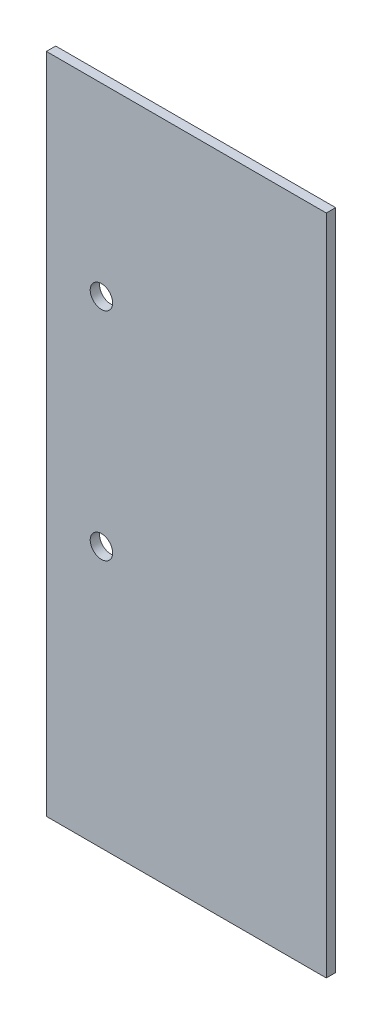
from build123d import *

# Parameters (mm, degrees)
ESQUISSE1_W             = 150
ESQUISSE1_H             = 355
BOSS_EXTRU_1_DEPTH      = 5
ESQUISSE2_R             = 6
ENL_V_MAT_EXTRU_1_DEPTH = 20
ESQUISSE3_R             = 1.5
ENL_V_MAT_EXTRU_2_DEPTH = 2.25


with BuildPart() as part:
    # Esquisse1 → Boss.-Extru.1 (new body)
    with BuildSketch(Plane.XY):
        Rectangle(ESQUISSE1_W, ESQUISSE1_H)
    extrude(amount=BOSS_EXTRU_1_DEPTH)

    # Esquisse2 → Enlèv. mat.-Extru.1 (cut)
    with BuildSketch(Plane.XY.offset(5)):
        with Locations((-45.5, 78.5)):
            Circle(ESQUISSE2_R)
        with Locations((-45.5, -37.5)):
            Circle(ESQUISSE2_R)
    extrude(amount=-ENL_V_MAT_EXTRU_1_DEPTH, mode=Mode.SUBTRACT)

    # Esquisse3 → Enlèv. mat.-Extru.2 (cut)
    with BuildSketch(Plane(origin=(0, 0, 0), x_dir=(-1, 0, 0), z_dir=(0, 0, -1))):
        with Locations((1.188690161, 154.472601824)):
            Circle(ESQUISSE3_R)
        with Locations((51.906289441, 163.445482985)):
            Circle(ESQUISSE3_R)
        with Locations((7.529151507, 118.554842214)):
            Circle(ESQUISSE3_R)
        with Locations((58.246291945, 127.500325199)):
            Circle(ESQUISSE3_R)
        with Locations((7.529151507, -77.584842214)):
            Circle(ESQUISSE3_R)
        with Locations((58.246291945, -86.530325199)):
            Circle(ESQUISSE3_R)
        with Locations((1.188690161, -113.502601824)):
            Circle(ESQUISSE3_R)
        with Locations((51.906289441, -122.475482985)):
            Circle(ESQUISSE3_R)
    extrude(amount=-ENL_V_MAT_EXTRU_2_DEPTH, mode=Mode.SUBTRACT)


solid = part.part
